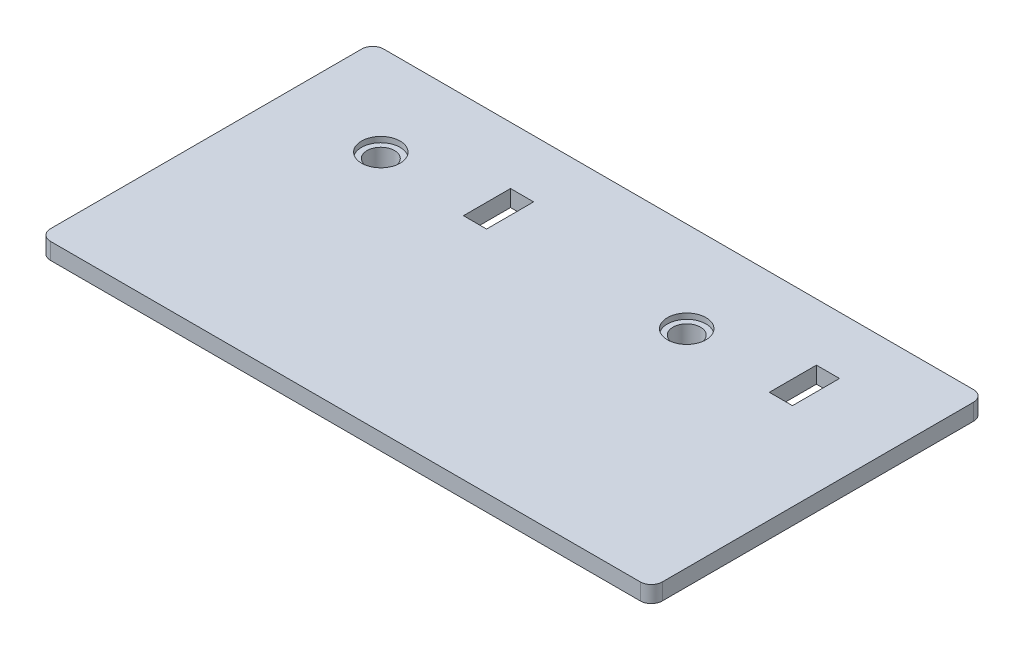
from build123d import *

# Parameters (mm, degrees)
SKETCH1_W           = 111.1
SKETCH1_H           = 60.5
BOSS_EXTRUDE1_DEPTH = 3
SKETCH9_W           = 5
SKETCH9_H           = 4
BOSS_EXTRUDE5_DEPTH = 3
FILLET1_R           = 2
SKETCH10_R          = 2.5
SKETCH10_W          = 4.2
SKETCH10_H          = 8.55
CUT_EXTRUDE1_DEPTH  = 10
SKETCH11_R          = 3.5
CUT_EXTRUDE2_DEPTH  = 1
SKETCH12_R          = 3.5
SKETCH12_R_2        = 2.5
BOSS_EXTRUDE6_DEPTH = 5


with BuildPart() as part:
    # Sketch1 → Boss-Extrude1 (new body)
    with BuildSketch(Plane(origin=(0, 0, 0), x_dir=(1, 0, 0), z_dir=(0, 1, 0))):
        Rectangle(SKETCH1_W, SKETCH1_H)
    extrude(amount=BOSS_EXTRUDE1_DEPTH)

    # Sketch9 → Boss-Extrude5 (add)
    with BuildSketch(Plane.XZ):
        with Locations((-48.05, -25.25)):
            Rectangle(SKETCH9_W, SKETCH9_H)
        with Locations((48.05, -25.25)):
            Rectangle(SKETCH9_W, SKETCH9_H)
    extrude(amount=BOSS_EXTRUDE5_DEPTH)

    # Fillet1
    fillet1_edges = [part.edges().sort_by_distance(p)[0] for p in [
        (-55.55, 1.5, -30.25),
        (55.55, 1.5, -30.25),
        (55.55, 1.5, 30.25),
        (-55.55, 1.5, 30.25),
    ]]
    fillet(fillet1_edges, radius=FILLET1_R)

    # Sketch10 → Cut-Extrude1 (cut)
    with BuildSketch(Plane(origin=(0, 3, 0), x_dir=(1, 0, 0), z_dir=(0, 1, 0))):
        with Locations(Location((-37.6, 13.78, 0), (0, 0, 270))):
            Circle(SKETCH10_R)
        with Locations(Location((17.95, 13.78, 0), (0, 0, 270))):
            Circle(SKETCH10_R)
        with Locations((37.55, 15.555)):
            Rectangle(SKETCH10_W, SKETCH10_H)
        with Locations((-18, 15.555)):
            Rectangle(SKETCH10_W, SKETCH10_H)
    extrude(amount=-CUT_EXTRUDE1_DEPTH, mode=Mode.SUBTRACT)

    # Sketch11 → Cut-Extrude2 (cut)
    with BuildSketch(Plane(origin=(0, 3, 0), x_dir=(1, 0, 0), z_dir=(0, 1, 0))):
        with Locations(Location((-37.6, 13.78, 0), (0, 0, 270))):
            Circle(SKETCH11_R)
        with Locations(Location((17.95, 13.78, 0), (0, 0, 270))):
            Circle(SKETCH11_R)
    extrude(amount=-CUT_EXTRUDE2_DEPTH, mode=Mode.SUBTRACT)

    # Sketch12 → Boss-Extrude6 (add)
    # profile 1 of 2: a face of its own
    with BuildSketch(Plane.XZ):
        with Locations(Location((17.95, -13.78, 0), (0, 0, 90))):
            Circle(SKETCH12_R)
        with Locations(Location((17.95, -13.78, 0), (0, 0, 90))):
            Circle(SKETCH12_R_2, mode=Mode.SUBTRACT)
    # profile 2 of 2: a face of its own
    with BuildSketch(Plane.XZ):
        with Locations(Location((-37.6, -13.78, 0), (0, 0, 90))):
            Circle(SKETCH12_R)
        with Locations(Location((-37.6, -13.78, 0), (0, 0, 90))):
            Circle(SKETCH12_R_2, mode=Mode.SUBTRACT)
    extrude(amount=BOSS_EXTRUDE6_DEPTH)


solid = part.part
